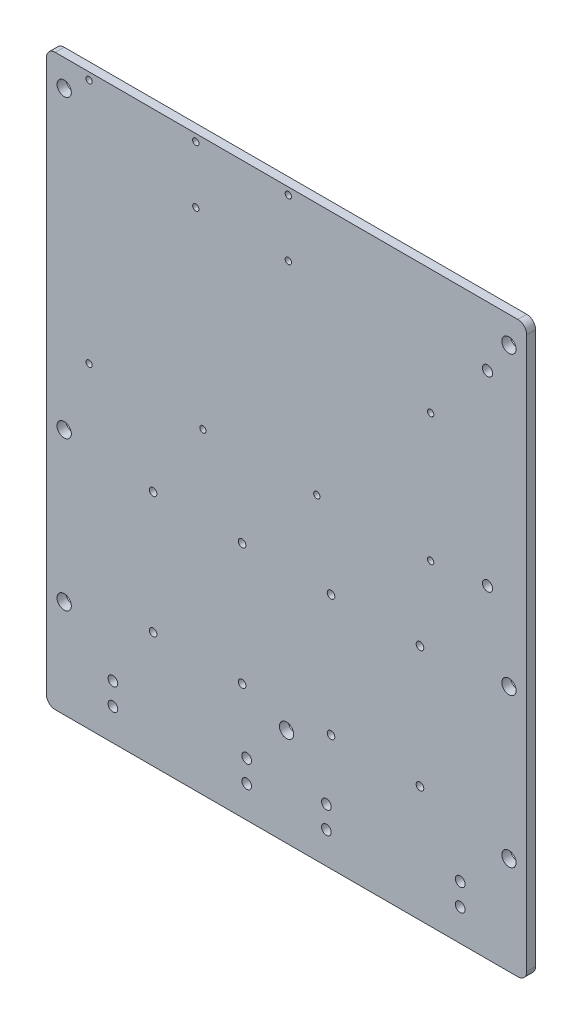
from build123d import *

# Parameters (mm, degrees)
SKETCH1_W              = 171.45
SKETCH1_H              = 203.2
BOSS_EXTRUDE1_DEPTH    = 3.175
F_10_CLEARANCE_HOLE1_D = 5.1054
F_6_32_TAPPED_HOLE1_D  = 2.7051
LPATTERN1_COUNT        = 4
LPATTERN1_PITCH        = 31.75
F_8_32_TAPPED_HOLE1_D  = 3.4544
M3_CLEARANCE_HOLE1_D   = 3.6
FILLET1_R              = 3.175
F_4_40_TAPPED_HOLE1_D  = 2.2606


with BuildPart() as part:
    # Sketch1 → Boss-Extrude1 (new body)
    with BuildSketch(Plane.XY):
        Rectangle(SKETCH1_W, SKETCH1_H)
    extrude(amount=BOSS_EXTRUDE1_DEPTH)

    # #10 Clearance Hole1 (through all)
    with Locations(Plane.XY.offset(3.175)):
        with Locations((-79.375, 92.075), (79.375, 92.075), (79.375, -66.675), (-79.375, -66.675), (-79.375, -13.462), (79.375, -13.462), (0, -66.675)):
            Hole(F_10_CLEARANCE_HOLE1_D / 2)

    # #6-32 Tapped Hole1 (through all)
    with Locations(Plane.XY.offset(3.175)):
        with Locations((-47.625, -60.2), (-47.625, -16.8)):
            f_6_32_tapped_hole1 = Hole(F_6_32_TAPPED_HOLE1_D / 2)

    # LPattern1: #6-32 Tapped Hole1 ×4
    with Locations(*[(i * LPATTERN1_PITCH, 0, 0) for i in range(1, LPATTERN1_COUNT)]):
        add(f_6_32_tapped_hole1, mode=Mode.SUBTRACT)

    # #8-32 Tapped Hole1 (through all)
    with Locations(Plane.XY.offset(3.175)):
        with Locations((-61.976, -82.423), (-61.976, -90.297), (-14.224, -82.423), (-14.224, -90.297)):
            f_8_32_tapped_hole1 = Hole(F_8_32_TAPPED_HOLE1_D / 2)

    # Mirror1: #8-32 Tapped Hole1 across plane
    add(f_8_32_tapped_hole1.mirror(Plane(origin=(0, 0, 0), x_dir=(0, 0, 1), z_dir=(1, 0, 0))), mode=Mode.SUBTRACT)

    # M3 Clearance Hole1 (through all)
    with Locations(Plane(origin=(0, 0, 0), x_dir=(-1, 0, 0), z_dir=(0, 0, -1))):
        with Locations((-71.725, 80.33377417), (-71.725, 13.83377417)):
            Hole(M3_CLEARANCE_HOLE1_D / 2)

    # Fillet1
    fillet1_edges = [part.edges().sort_by_distance(p)[0] for p in [
        (85.725, -101.6, 1.5875),
        (-85.725, -101.6, 1.5875),
        (-85.725, 101.6, 1.5875),
        (85.725, 101.6, 1.5875),
    ]]
    fillet(fillet1_edges, radius=FILLET1_R)

    # #4-40 Tapped Hole1 (through all)
    with Locations(Plane.XY.offset(3.175)):
        with Locations((-70.485, 99.06), (-32.385, 78.74), (-32.385, 99.06), (0.635, 99.06), (0.635, 78.74), (-70.485, 11.43), (-29.845, 11.43), (10.795, 11.43), (51.435, 11.43), (51.435, 57.15)):
            Hole(F_4_40_TAPPED_HOLE1_D / 2)


solid = part.part
